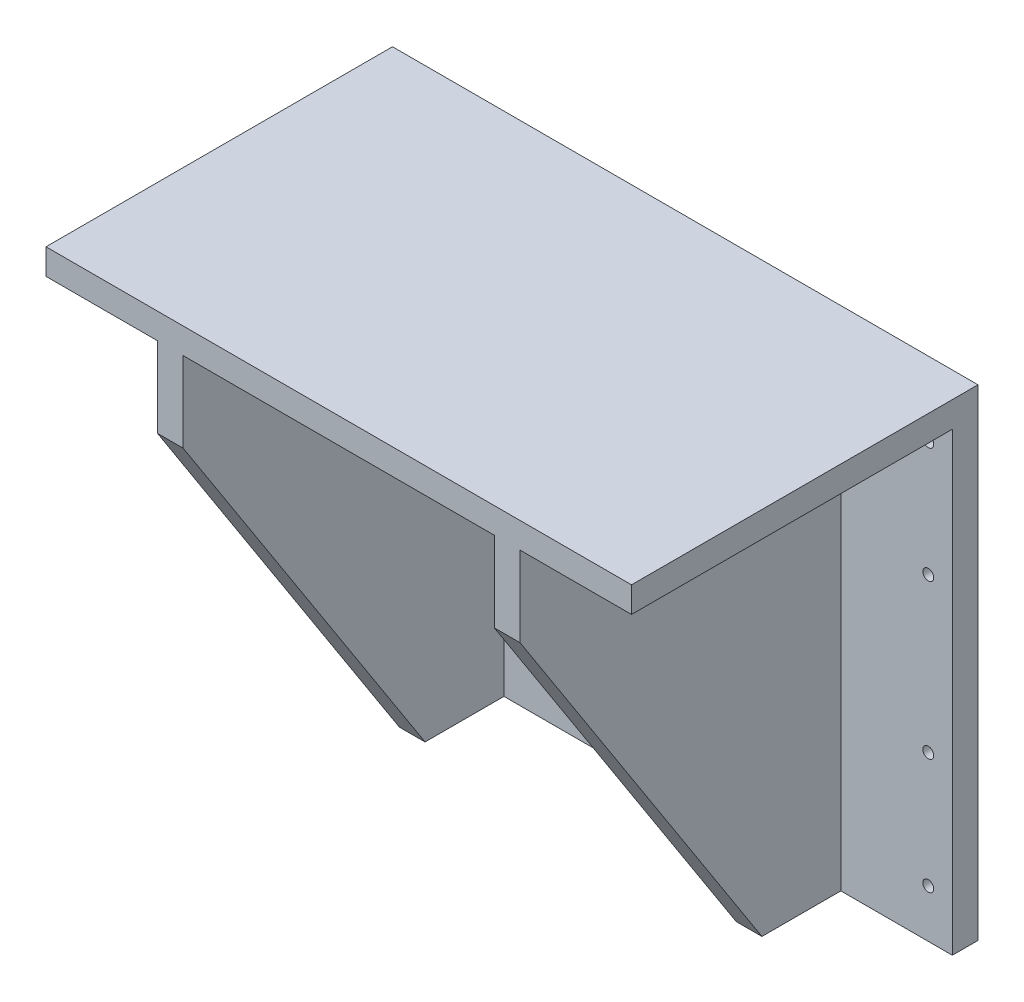
from build123d import *

# Parameters (mm, degrees)
SKETCH1_W              = 365
SKETCH1_H              = 300
BOSS_EXTRUDE1_DEPTH    = 16
SKETCH2_W              = 365
SKETCH2_H              = 16
BOSS_EXTRUDE2_DEPTH    = 200
BOSS_EXTRUDE3_START    = -69.5
BOSS_EXTRUDE3_DEPTH    = 16
BOSS_EXTRUDE4_START    = 194
BOSS_EXTRUDE4_DEPTH    = 16
M8X1_25_TAPPED_HOLE1_D = 6.8
LPATTERN1_COUNT        = 2
LPATTERN1_PITCH        = 335


with BuildPart() as part:
    # Sketch1 → Boss-Extrude1 (new body)
    with BuildSketch(Plane.XY):
        with Locations((0, -150)):
            Rectangle(SKETCH1_W, SKETCH1_H)
    extrude(amount=BOSS_EXTRUDE1_DEPTH)

    # Sketch2 → Boss-Extrude2 (add)
    with BuildSketch(Plane.XY.offset(16)):
        with Locations((0, -8)):
            Rectangle(SKETCH2_W, SKETCH2_H)
    extrude(amount=BOSS_EXTRUDE2_DEPTH)

    # Sketch3 → Boss-Extrude3 (add)
    with BuildSketch(Plane(origin=(182.5, 0, 0), x_dir=(0, 0, -1), z_dir=(1, 0, 0)).offset(BOSS_EXTRUDE3_START)):
        Polygon((-216, -16), (-216, -66), (-65.197290638, -300), (-16, -300), (-16, -16), align=None)
    extrude(amount=-BOSS_EXTRUDE3_DEPTH)

    # Sketch4 → Boss-Extrude4 (add)
    with BuildSketch(Plane.ZY.offset(-97).offset(BOSS_EXTRUDE4_START)):
        Polygon((216, -16), (16, -16), (16, -300), (65.197290638, -300), (216, -66), align=None)
    extrude(amount=BOSS_EXTRUDE4_DEPTH)

    # M8x1.25 Tapped Hole1 (through all)
    with Locations(Plane.XY.offset(16)):
        with Locations((167.5, -30), (167.5, -270), (167.5, -198), (167.5, -102)):
            m8x1_25_tapped_hole1 = Hole(M8X1_25_TAPPED_HOLE1_D / 2)

    # LPattern1: M8x1.25 Tapped Hole1 ×2
    with Locations(*[(-i * LPATTERN1_PITCH, 0, 0) for i in range(1, LPATTERN1_COUNT)]):
        add(m8x1_25_tapped_hole1, mode=Mode.SUBTRACT)


solid = part.part
